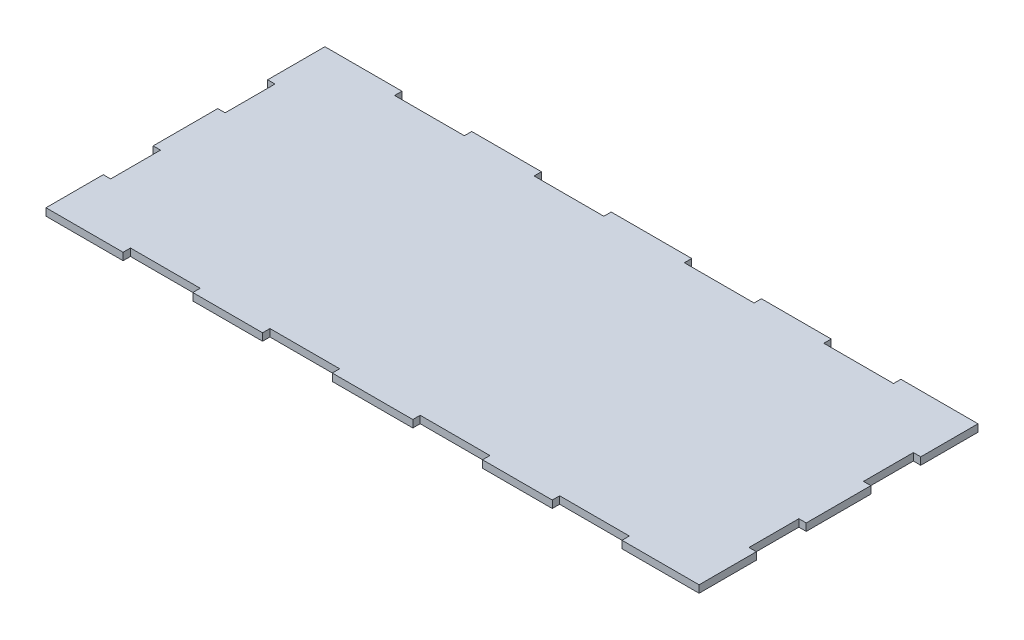
from build123d import *

# Parameters (mm, degrees)
SALIENTE_EXTRUIR1_DEPTH = 3


with BuildPart() as part:
    # Croquis1 → Saliente-Extruir1 (new body)
    with BuildSketch(Plane(origin=(0, 0, 0), x_dir=(1, 0, 0), z_dir=(0, 1, 0))):
        Polygon((3, 113.6), (31.4, 113.6), (31.4, 110.6), (59.8, 110.6), (59.8, 113.6), (88.2, 113.6), (88.2, 110.6), (116.6, 110.6), (116.6, 113.6), (149.4, 113.6), (149.4, 110.6), (177.8, 110.6), (177.8, 113.6), (206.2, 113.6), (206.2, 110.6), (234.6, 110.6), (234.6, 113.6), (263, 113.6), (266, 113.6), (266, 110.6), (266, 90.28), (263, 90.28), (263, 69.96), (266, 69.96), (266, 43.64), (263, 43.64), (263, 23.32), (266, 23.32), (266, 3), (266, 0), (263, 0), (234.6, 0), (234.6, 3), (206.2, 3), (206.2, 0), (177.8, 0), (177.8, 3), (149.4, 3), (149.4, 0), (116.6, 0), (116.6, 3), (88.2, 3), (88.2, 0), (59.8, 0), (59.8, 3), (31.4, 3), (31.4, 0), (3, 0), (0, 0), (0, 3), (0, 23.32), (3, 23.32), (3, 43.64), (0, 43.64), (0, 69.96), (3, 69.96), (3, 90.28), (0, 90.28), (0, 110.6), (0, 113.6), align=None)
    extrude(amount=SALIENTE_EXTRUIR1_DEPTH)


solid = part.part
